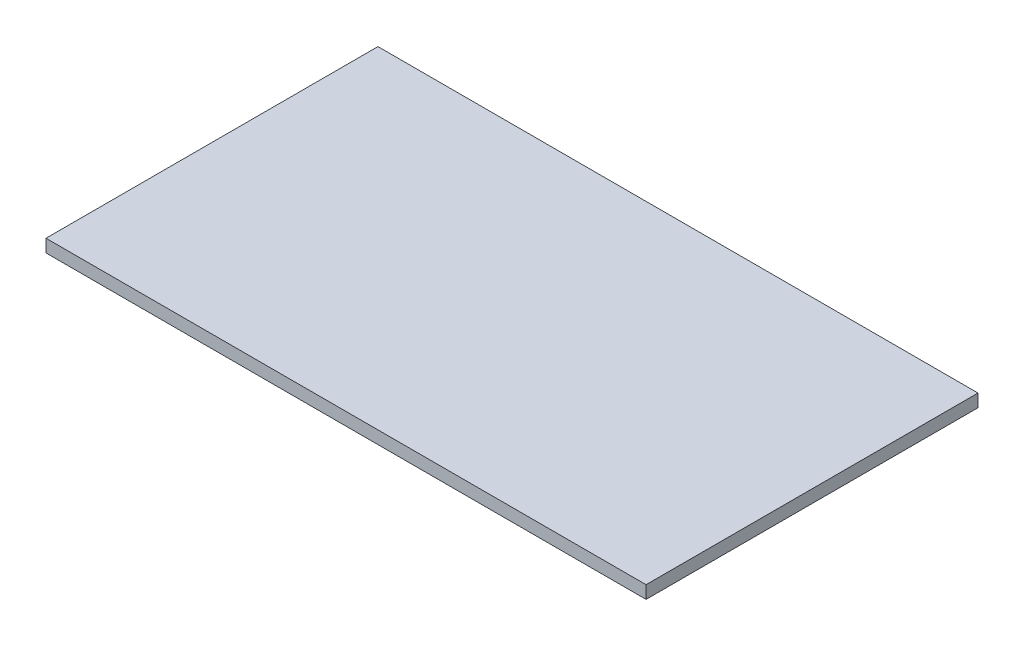
from build123d import *

# Parameters (mm, degrees)
SKETCH1_W           = 298.45
SKETCH1_H           = 165.1
BOSS_EXTRUDE1_DEPTH = 6.35


with BuildPart() as part:
    # Sketch1 → Boss-Extrude1 (new body)
    with BuildSketch(Plane(origin=(0, 0, 0), x_dir=(1, 0, 0), z_dir=(0, 1, 0))):
        Rectangle(SKETCH1_W, SKETCH1_H)
    extrude(amount=BOSS_EXTRUDE1_DEPTH)


solid = part.part
